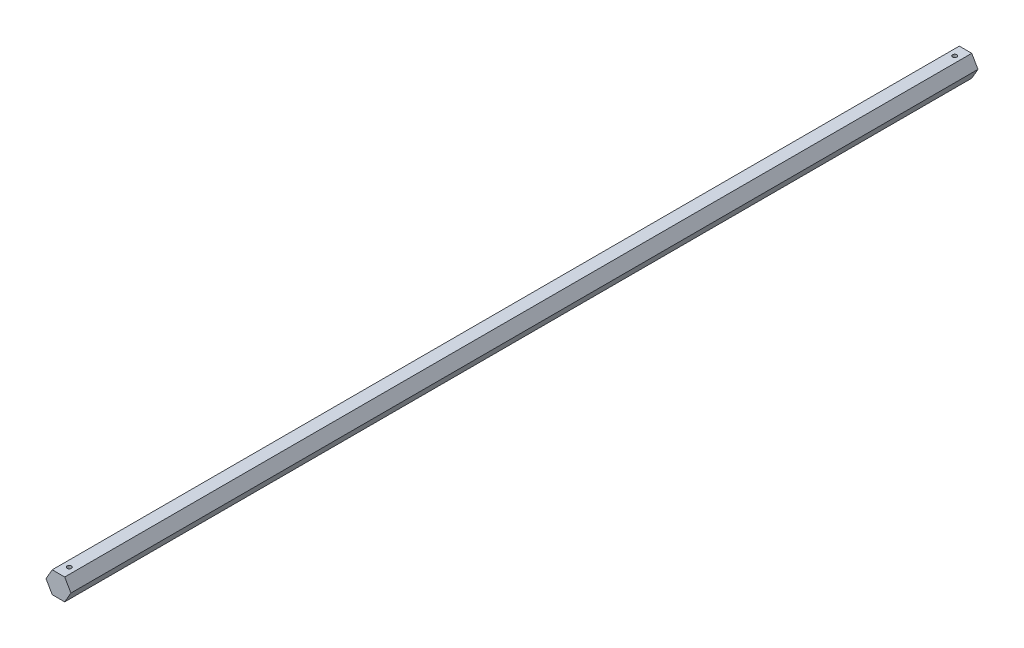
from build123d import *

# Parameters (mm, degrees)
BOSS_EXTRUDE1_DEPTH = 266.7
SKETCH2_R           = 1.2573
CUT_EXTRUDE1_DEPTH  = 268.10287032


with BuildPart() as part:
    # Sketch1 → Boss-Extrude1 (new, symmetric)
    with BuildSketch(Plane.XY):
        Polygon((3.666174209, -6.35), (7.332348419, 0), (3.666174209, 6.35), (-3.666174209, 6.35), (-7.332348419, 0), (-3.666174209, -6.35), align=None)
    extrude(amount=BOSS_EXTRUDE1_DEPTH, both=True)

    # Sketch2 → Cut-Extrude1 (cut, through all)
    with BuildSketch(Plane(origin=(0, 6.35, 0), x_dir=(1, 0, 0), z_dir=(0, 1, 0))):
        with Locations(Location((0, -260.35, 0), (0, 0, 180))):
            Circle(SKETCH2_R)
        with Locations(Location((0, 260.35, 0), (0, 0, 180))):
            Circle(SKETCH2_R)
    extrude(amount=-CUT_EXTRUDE1_DEPTH, mode=Mode.SUBTRACT)


solid = part.part
